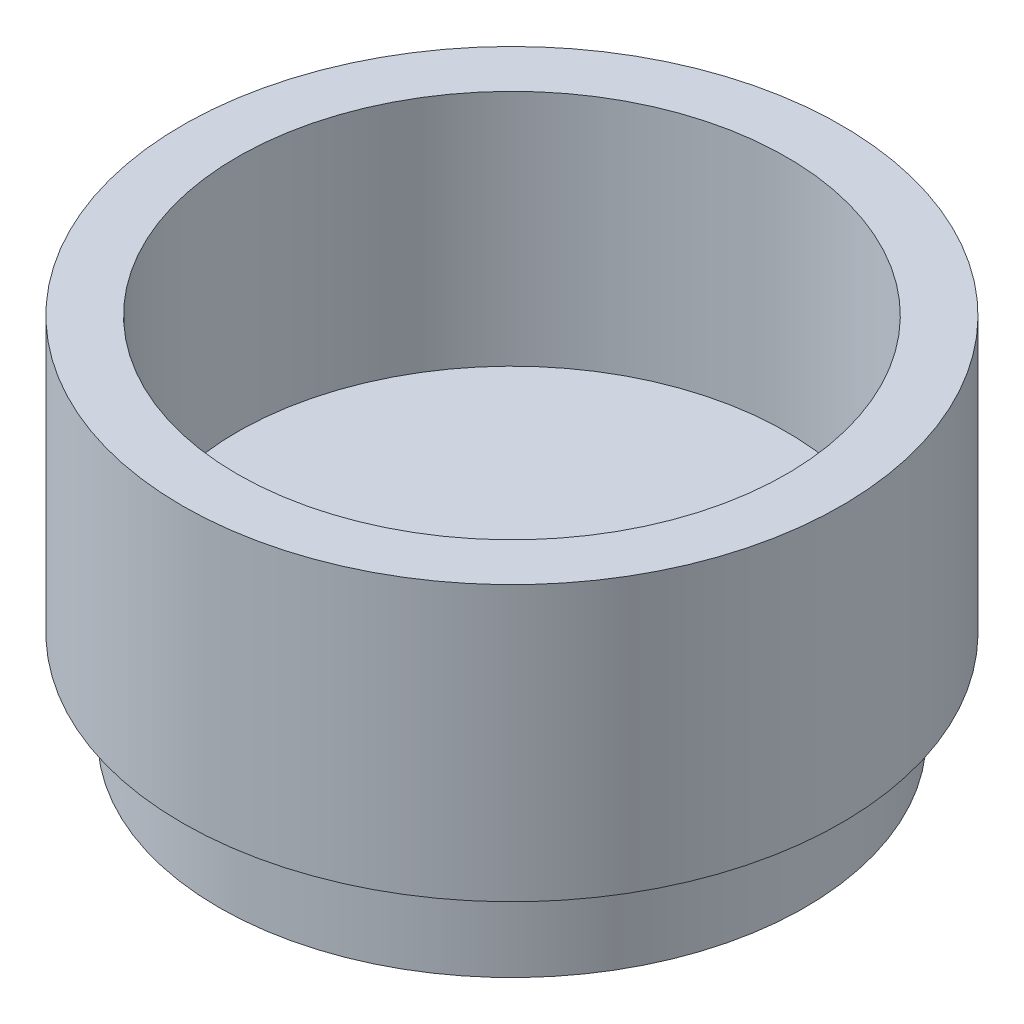
from build123d import *

# Parameters (mm, degrees)
SKETCH1_R           = 160
BOSS_EXTRUDE1_DEPTH = 50
SKETCH2_R           = 180
BOSS_EXTRUDE2_DEPTH = 150
SKETCH3_R           = 150
CUT_EXTRUDE1_DEPTH  = 130


with BuildPart() as part:
    # Sketch1 → Boss-Extrude1 (new body)
    with BuildSketch(Plane(origin=(0, 0, 0), x_dir=(1, 0, 0), z_dir=(0, 1, 0))):
        with Locations(Location((0, 0, 0), (0, 0, 270))):
            Circle(SKETCH1_R)
    extrude(amount=BOSS_EXTRUDE1_DEPTH)

    # Sketch2 → Boss-Extrude2 (add)
    with BuildSketch(Plane(origin=(0, 50, 0), x_dir=(1, 0, 0), z_dir=(0, 1, 0))):
        with Locations(Location((0, 0, 0), (0, 0, 270))):
            Circle(SKETCH2_R)
    extrude(amount=BOSS_EXTRUDE2_DEPTH)

    # Sketch3 → Cut-Extrude1 (cut)
    with BuildSketch(Plane(origin=(0, 200, 0), x_dir=(1, 0, 0), z_dir=(0, 1, 0))):
        with Locations(Location((0, 0, 0), (0, 0, 270))):
            Circle(SKETCH3_R)
    extrude(amount=-CUT_EXTRUDE1_DEPTH, mode=Mode.SUBTRACT)


solid = part.part
